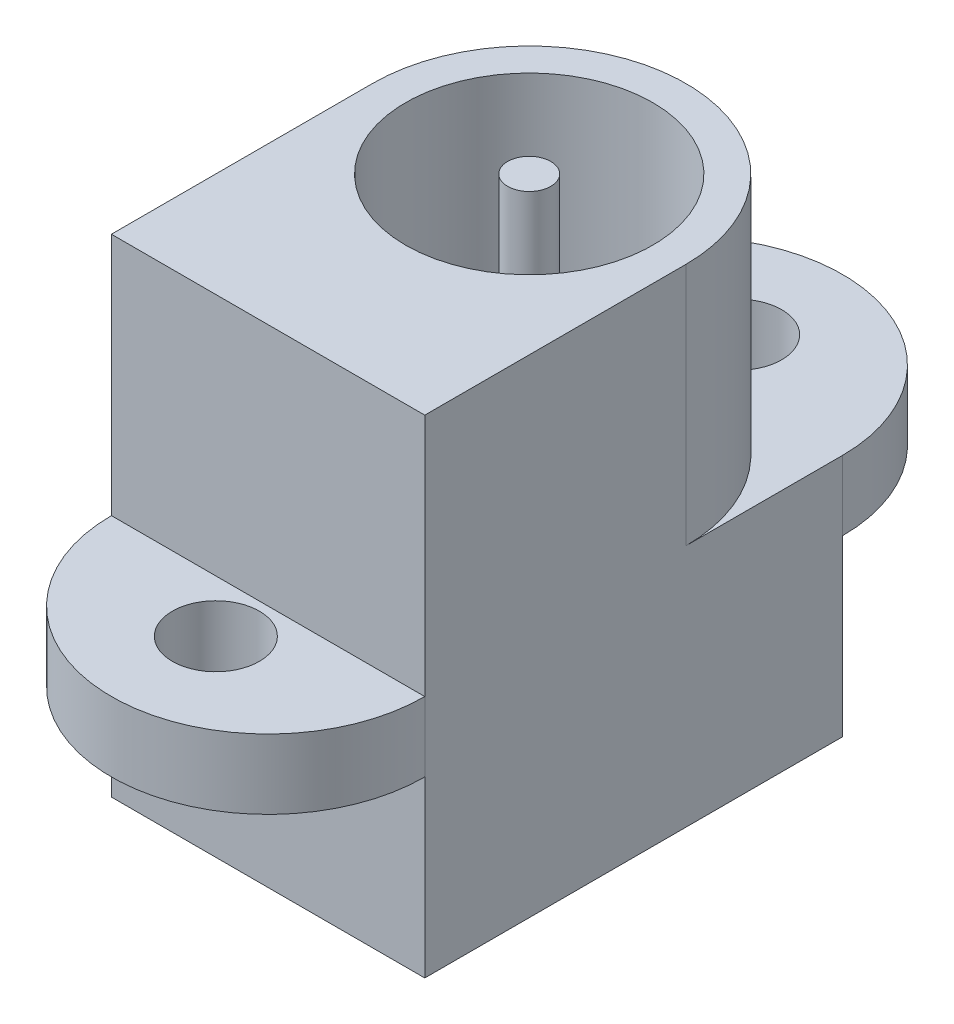
from build123d import *

# Parameters (mm, degrees)
ESQUISSE1_R      = 1.25
EXTRUSION1_DEPTH = 2
ESQUISSE2_R      = 3.548892627
ESQUISSE2_R_2    = 0.619205298
EXTRUSION2_DEPTH = 7
ESQUISSE3_W      = 9
ESQUISSE3_H      = 12
EXTRUSION3_DEPTH = 5


with BuildPart() as part:
    # Esquisse1 → Extrusion1 (new body)
    with BuildSketch(Plane(origin=(0, 0, 0), x_dir=(1, 0, 0), z_dir=(0, 1, 0))):
        with BuildLine():
            Line((-4.5, 6), (-4.5, -6))
            ThreePointArc((-4.5, -6), (0, -10.5), (4.5, -6))
            Line((4.5, -6), (4.5, 6))
            ThreePointArc((4.5, 6), (0, 10.5), (-4.5, 6))
        make_face()
        with Locations(Location((0, 7.5, 0), (0, 0, 270))):
            Circle(ESQUISSE1_R, mode=Mode.SUBTRACT)
        with Locations(Location((0, -7.5, 0), (0, 0, 270))):
            Circle(ESQUISSE1_R, mode=Mode.SUBTRACT)
    extrude(amount=-EXTRUSION1_DEPTH)

    # Esquisse2 → Extrusion2 (add)
    # profile 1 of 2: a face of its own
    with BuildSketch(Plane(origin=(0, 0, 0), x_dir=(-1, 0, 0), z_dir=(0, 1, 0))):
        with BuildLine():
            Line((4.5, -1.5), (4.5, 6))
            Line((4.5, 6), (-4.5, 6))
            Line((-4.5, 6), (-4.5, -1.5))
            ThreePointArc((-4.5, -1.5), (0, -6), (4.5, -1.5))
        make_face()
        with Locations(Location((0, -1.5, 0), (0, 0, 90))):
            Circle(ESQUISSE2_R, mode=Mode.SUBTRACT)
    # profile 2 of 2: a face of its own
    with BuildSketch(Plane(origin=(0, 0, 0), x_dir=(-1, 0, 0), z_dir=(0, 1, 0))):
        with Locations(Location((0, -1.5, 0), (0, 0, 90))):
            Circle(ESQUISSE2_R_2)
    extrude(amount=EXTRUSION2_DEPTH)

    # Esquisse3 → Extrusion3 (add)
    with BuildSketch(Plane.XZ.offset(2)):
        Rectangle(ESQUISSE3_W, ESQUISSE3_H)
    extrude(amount=EXTRUSION3_DEPTH)


solid = part.part
